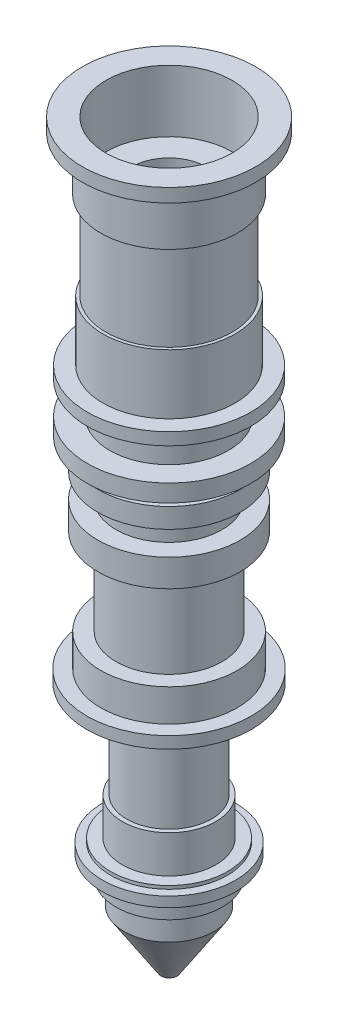
from build123d import *

# Parameters (mm, degrees)
SKETCH_2_R      = 4
EXTRUDE_1_DEPTH = 11.36
EXTRUDE_2_DEPTH = 102
SKETCH_4_R      = 3.42
EXTRUDE_3_DEPTH = 22


with BuildPart() as part:
    # 草图1 → 旋转1 (revolve)
    with BuildSketch(Plane.XY, mode=Mode.PRIVATE) as revolve_1_sk:
        Polygon((0, 0), (7.5, 0), (42.09, 53.35), (42.09, 76.73), (49.525, 76.73), (49.525, 95.5), (62.215, 95.5), (62.215, 104.91), (54.51, 104.91), (54.51, 107.98), (43.65, 107.98), (43.65, 142.98), (39.635, 142.98), (39.635, 246.28), (42.62, 246.28), (42.62, 233.91), (76.8, 233.91), (76.8, 244.9), (63.67, 244.9), (63.67, 275.1), (49.47, 275.1), (49.47, 356.23), (66.395, 356.23), (66.395, 381.8), (49.47, 381.8), (49.47, 404.27), (66.395, 404.27), (66.395, 422.79), (39.72, 422.79), (39.72, 432.61), (76.34, 432.61), (76.34, 448.79), (55.36, 448.79), (55.36, 478.82), (76.34, 478.82), (76.34, 490.29), (61.69, 490.29), (61.69, 546.17), (58.9, 546.17), (58.9, 628.71), (63.765, 628.71), (63.765, 678.34), (80.93, 678.34), (80.93, 690.98), (58.9, 690.98), (58.9, 633.2), (34.64, 633.2), (34.64, 422.88), (0, 422.88), align=None)
    revolve(revolve_1_sk.sketch.rotate(Axis((0, 0, 0), (0, 1, 0)), 90), axis=Axis((0, 0, 0), (0, 1, 0)))

    # 草图2 → 凸台-拉伸1 (add)
    with BuildSketch(Plane(origin=(0, 422.88, 0), x_dir=(1, 0, 0), z_dir=(0, 1, 0))):
        with Locations(Location((0, 0, 0), (0, 0, 90))):
            Circle(SKETCH_2_R)
    extrude(amount=EXTRUDE_1_DEPTH)

    # 草图3 → 凸台-拉伸2 (add)
    with BuildSketch(Plane(origin=(0, 434.24, 0), x_dir=(1, 0, 0), z_dir=(0, 1, 0))):
        Polygon((7.349668927, 0), (3.674834463, 6.365), (-3.674834463, 6.365), (-7.349668927, 0), (-3.674834463, -6.365), (3.674834463, -6.365), align=None)
    extrude(amount=EXTRUDE_2_DEPTH)

    # 草图4 → 凸台-拉伸3 (add)
    with BuildSketch(Plane(origin=(0, 536.24, 0), x_dir=(1, 0, 0), z_dir=(0, 1, 0))):
        with Locations(Location((0, 0, 0), (0, 0, 270))):
            Circle(SKETCH_4_R)
    extrude(amount=EXTRUDE_3_DEPTH)


solid = part.part
